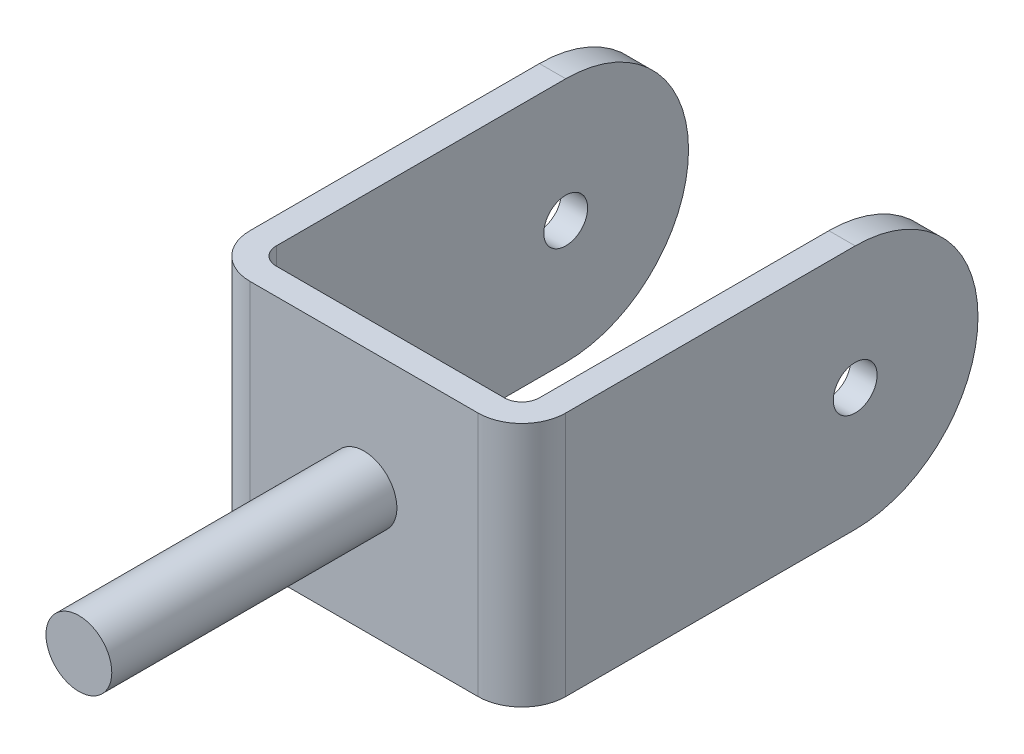
from build123d import *

# Parameters (mm, degrees)
BOSS_EXTRUDE1_DEPTH = 280
SKETCH2_R           = 37.5
BOSS_EXTRUDE2_DEPTH = 325
SKETCH4_R           = 25
CUT_EXTRUDE1_DEPTH  = 692.664658632


with BuildPart() as part:
    # Sketch1 → Boss-Extrude1 (new body)
    with BuildSketch(Plane(origin=(0, 0, 0), x_dir=(1, 0, 0), z_dir=(0, 1, 0))):
        with BuildLine():
            Line((-130, 0), (130, 0))
            ThreePointArc((130, 0), (165.355339059, 14.644660941), (180, 50))
            Line((180, 50), (180, 520))
            Line((180, 520), (150, 520))
            Line((150, 520), (150, 50))
            ThreePointArc((150, 50), (144.142135624, 35.857864376), (130, 30))
            Line((130, 30), (-130, 30))
            ThreePointArc((-130, 30), (-144.142135624, 35.857864376), (-150, 50))
            Line((-150, 50), (-150, 520))
            Line((-150, 520), (-180, 520))
            Line((-180, 520), (-180, 50))
            ThreePointArc((-180, 50), (-165.355339059, 14.644660941), (-130, 0))
        make_face()
    extrude(amount=BOSS_EXTRUDE1_DEPTH)

    # Sketch2 → Boss-Extrude2 (add)
    with BuildSketch(Plane.XY):
        with Locations(Location((0, 140, 0), (0, 0, 180))):
            Circle(SKETCH2_R)
    extrude(amount=BOSS_EXTRUDE2_DEPTH)

    # Sketch4 → Cut-Extrude1 (cut, through all)
    with BuildSketch(Plane(origin=(180, 0, 0), x_dir=(0, 0, -1), z_dir=(1, 0, 0))):
        with Locations((380, 140)):
            Circle(SKETCH4_R)
        with BuildLine():
            Line((520, 280), (380, 280))
            ThreePointArc((380, 280), (478.994949366, 238.994949366), (520, 140))
            Line((520, 140), (520, 280))
        make_face()
        with BuildLine():
            Line((520, 0), (520, 140))
            ThreePointArc((520, 140), (478.994949366, 41.005050634), (380, 0))
            Line((380, 0), (520, 0))
        make_face()
    extrude(amount=-CUT_EXTRUDE1_DEPTH, mode=Mode.SUBTRACT)


solid = part.part
